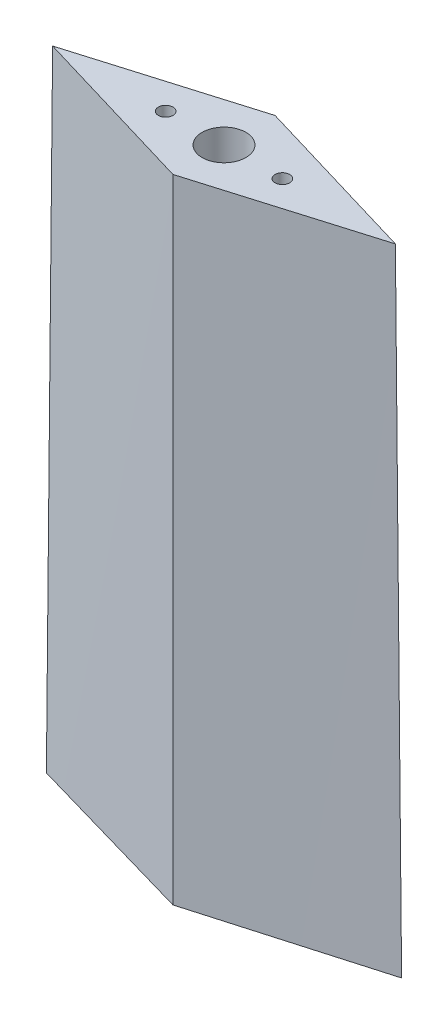
from build123d import *

# Parameters (mm, degrees)
BOSS_EXTRUDE1_DEPTH      = 11.1125
BOSS_EXTRUDE1_DEPTH_BACK = 11.1125
SKETCH5_W                = 109.877468776
SKETCH5_H                = 283.051122129
CUT_EXTRUDE2_DEPTH       = 1193.492852366
SKETCH6_W                = 149.121482991
SKETCH6_H                = 108.921761737
CUT_EXTRUDE3_DEPTH       = 1175.662940665
SKETCH7_R                = 4.7625
CUT_EXTRUDE4_DEPTH       = 635
CUT_EXTRUDE5_DEPTH       = 1195.766301895
CUT_EXTRUDE5_DEPTH_BACK  = 1195.766301895
SKETCH8_W                = 149.774750394
SKETCH8_H                = 142.875
SKETCH8_H_2              = 176.125878949
SKETCH9_R                = 1.5875
CUT_EXTRUDE6_DEPTH       = 12.7
CUT_EXTRUDE7_START       = -12.7
SKETCH10_R               = 1.5875
CUT_EXTRUDE7_DEPTH       = 12.7


with BuildPart() as part:
    # Sketch1 → Boss-Extrude1 (new, two sides: drawn at the far end of the back side and taken through both)
    with BuildSketch(Plane.XY.offset(-BOSS_EXTRUDE1_DEPTH_BACK)):
        Polygon((142.42123069, 465.168027231), (219.716026672, 465.168027231), (213.502471629, 1096.967634552), (181.068628681, 1174.337215652), (148.634785732, 1096.967634552), align=None)
    extrude(amount=BOSS_EXTRUDE1_DEPTH + BOSS_EXTRUDE1_DEPTH_BACK)

    # Sketch2 → Cut-Loft1 section 0
    with BuildSketch(Plane.XZ.offset(-465.168027231)):
        with BuildLine():
            Line((142.42123069, 0), (181.068628681, 11.1125))
            Line((181.068628681, 11.1125), (219.716026672, 0))
            Line((219.716026672, 0), (222.70513775, 0))
            Line((222.70513775, 0), (222.70513775, 15.258366339))
            Line((222.70513775, 15.258366339), (137.848628215, 15.258366339))
            Line((137.848628215, 15.258366339), (137.848628215, 0))
            Line((137.848628215, 0), (142.42123069, 0))
        make_face()
    # Sketch3 → Cut-Loft1 section 1
    with BuildSketch(Plane(origin=(0, 1096.967634552, 0), x_dir=(1, 0, 0), z_dir=(0, 1, 0))):
        with BuildLine():
            Line((213.502471629, 0), (181.068628681, -11.1125))
            Line((181.068628681, -11.1125), (148.634785732, 0))
            Line((148.634785732, 0), (137.848628215, 0))
            Line((137.848628215, 0), (137.848628215, -15.258366339))
            Line((137.848628215, -15.258366339), (222.70513775, -15.258366339))
            Line((222.70513775, -15.258366339), (222.70513775, 0))
            Line((222.70513775, 0), (213.502471629, 0))
        make_face()
    cut_loft1 = loft(mode=Mode.SUBTRACT)

    # Mirror1: Cut-Loft1 across plane
    add(cut_loft1.mirror(Plane.XY), mode=Mode.SUBTRACT)

    # Sketch5 → Cut-Extrude2 (cut, through all)
    with BuildSketch(Plane(origin=(-32.103098407, 13.457832356, 93.698704331), x_dir=(0.9470206004067627, 0.045661094409327196, 0.31791043842968925), z_dir=(-0.3211728232668741, 0.1346377834927197, 0.937401026696127))):
        with Locations((219.349244299, 1139.303724701)):
            Rectangle(SKETCH5_W, SKETCH5_H)
    cut_extrude2 = extrude(amount=CUT_EXTRUDE2_DEPTH, mode=Mode.SUBTRACT)

    # Sketch6 → Cut-Extrude3 (cut, through all)
    with BuildSketch(Plane(origin=(69.458274406, 29.117370568, 202.726547902), x_dir=(0.9470206004067623, -0.045661094409327495, -0.31791043842969063), z_dir=(0.3211728232668754, 0.13463778349272, 0.9374010266961263))):
        with Locations((131.752816965, 1118.922251835)):
            Rectangle(SKETCH6_W, SKETCH6_H)
    cut_extrude3 = extrude(amount=CUT_EXTRUDE3_DEPTH, mode=Mode.SUBTRACT)

    # Mirror2: Cut-Extrude2, Cut-Extrude3 across plane
    add(cut_extrude2.mirror(Plane.XY), mode=Mode.SUBTRACT)
    add(cut_extrude3.mirror(Plane.XY), mode=Mode.SUBTRACT)

    # Sketch7 → Cut-Extrude4 (cut)
    with BuildSketch(Plane.XZ.offset(-465.168027231)):
        with Locations(Location((181.068628681, 0, 0), (0, 0, 270))):
            Circle(SKETCH7_R)
    extrude(amount=-CUT_EXTRUDE4_DEPTH, mode=Mode.SUBTRACT)

    # Sketch8 → Cut-Extrude5 (cut, two sides: drawn at the far end of the back side and taken through both)
    with BuildSketch(Plane.XY.offset(-CUT_EXTRUDE5_DEPTH_BACK)):
        with Locations((180.5976389, 674.274715652)):
            Rectangle(SKETCH8_W, SKETCH8_H)
        with Locations((180.5976389, 817.149715652)):
            Rectangle(SKETCH8_W, SKETCH8_H)
        with Locations((180.5976389, 960.024715652)):
            Rectangle(SKETCH8_W, SKETCH8_H)
        with Locations((180.5976389, 1119.525155127)):
            Rectangle(SKETCH8_W, SKETCH8_H_2)
    extrude(amount=CUT_EXTRUDE5_DEPTH + CUT_EXTRUDE5_DEPTH_BACK, mode=Mode.SUBTRACT)

    # Sketch9 → Cut-Extrude6 (cut)
    with BuildSketch(Plane.XZ.offset(-465.168027231)):
        with Locations(Location((168.368628681, 0, 0), (0, 0, 270))):
            Circle(SKETCH9_R)
        with Locations(Location((193.768628681, 0, 0), (0, 0, 270))):
            Circle(SKETCH9_R)
    extrude(amount=-CUT_EXTRUDE6_DEPTH, mode=Mode.SUBTRACT)

    # Sketch10 → Cut-Extrude7 (cut)
    with BuildSketch(Plane(origin=(0, 602.837215652, 0), x_dir=(1, 0, 0), z_dir=(0, 1, 0)).offset(CUT_EXTRUDE7_START)):
        with Locations(Location((168.368628681, 0, 0), (0, 0, 90))):
            Circle(SKETCH10_R)
        with Locations(Location((193.768628681, 0, 0), (0, 0, 90))):
            Circle(SKETCH10_R)
    extrude(amount=CUT_EXTRUDE7_DEPTH, mode=Mode.SUBTRACT)


solid = part.part
